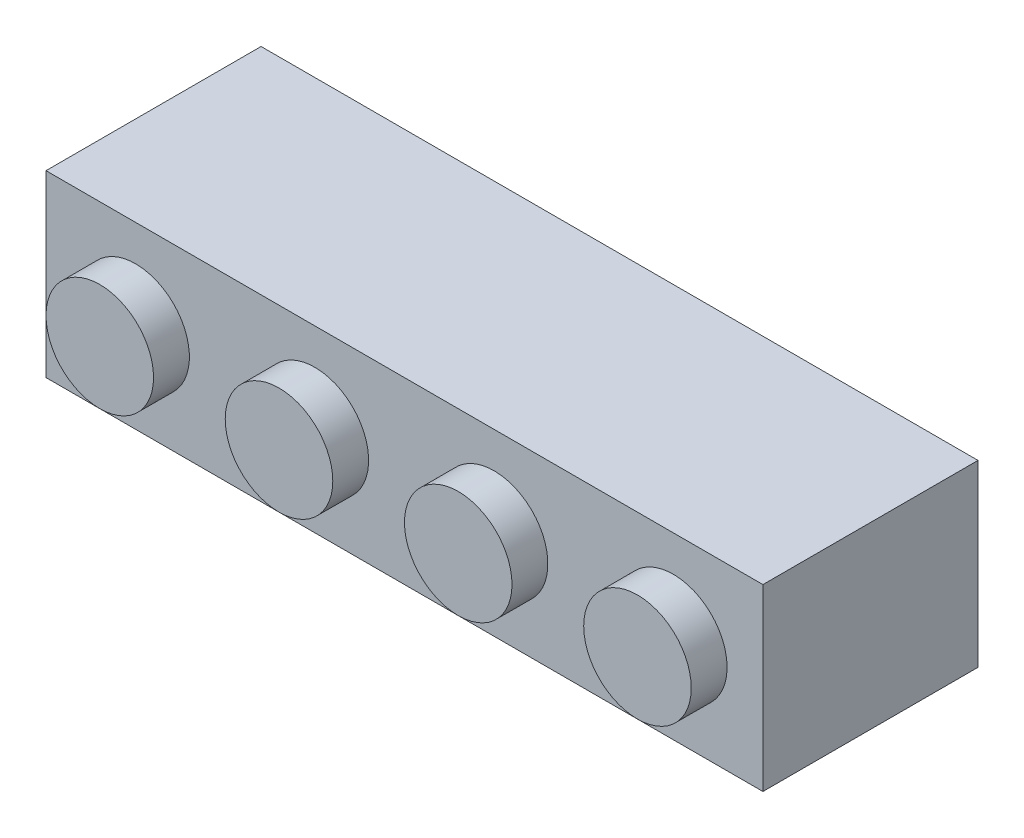
from build123d import *

# Parameters (mm, degrees)
SKETCH1_W           = 32
SKETCH1_H           = 8
BOSS_EXTRUDE1_DEPTH = 9.6
SKETCH2_R           = 2.4
BOSS_EXTRUDE2_DEPTH = 1.6
LPATTERN1_COUNT     = 4
LPATTERN1_PITCH     = 8
SHELL1_T            = -1.6
SKETCH3_R           = 1.6
BOSS_EXTRUDE3_DEPTH = 8
LPATTERN2_COUNT     = 3
LPATTERN2_PITCH     = 8


with BuildPart() as part:
    # Sketch1 → Boss-Extrude1 (new body)
    with BuildSketch(Plane.XY):
        with Locations((16, 4)):
            Rectangle(SKETCH1_W, SKETCH1_H)
    extrude(amount=BOSS_EXTRUDE1_DEPTH)

    # Sketch2 → Boss-Extrude2 (add)
    with BuildSketch(Plane.XY.offset(9.6)):
        with Locations(Location((4, 4, 0), (0, 0, 180))):
            Circle(SKETCH2_R)
    boss_extrude2 = extrude(amount=BOSS_EXTRUDE2_DEPTH)

    # LPattern1: Boss-Extrude2 ×4
    with Locations(*[(i * LPATTERN1_PITCH, 0, 0) for i in range(1, LPATTERN1_COUNT)]):
        add(boss_extrude2)

    # Shell1
    shell1_openings = [part.faces().sort_by_distance(p)[0] for p in [
        (16, 4, 0),
    ]]
    offset(amount=SHELL1_T, openings=shell1_openings, kind=Kind.INTERSECTION)

    # Sketch3 → Boss-Extrude3 (add)
    with BuildSketch(Plane(origin=(0, 0, 8), x_dir=(-1, 0, 0), z_dir=(0, 0, -1))):
        with Locations((-8, 4)):
            Circle(SKETCH3_R)
    boss_extrude3 = extrude(amount=BOSS_EXTRUDE3_DEPTH)

    # LPattern2: Boss-Extrude3 ×3
    with Locations(*[(i * LPATTERN2_PITCH, 0, 0) for i in range(1, LPATTERN2_COUNT)]):
        add(boss_extrude3)


solid = part.part
